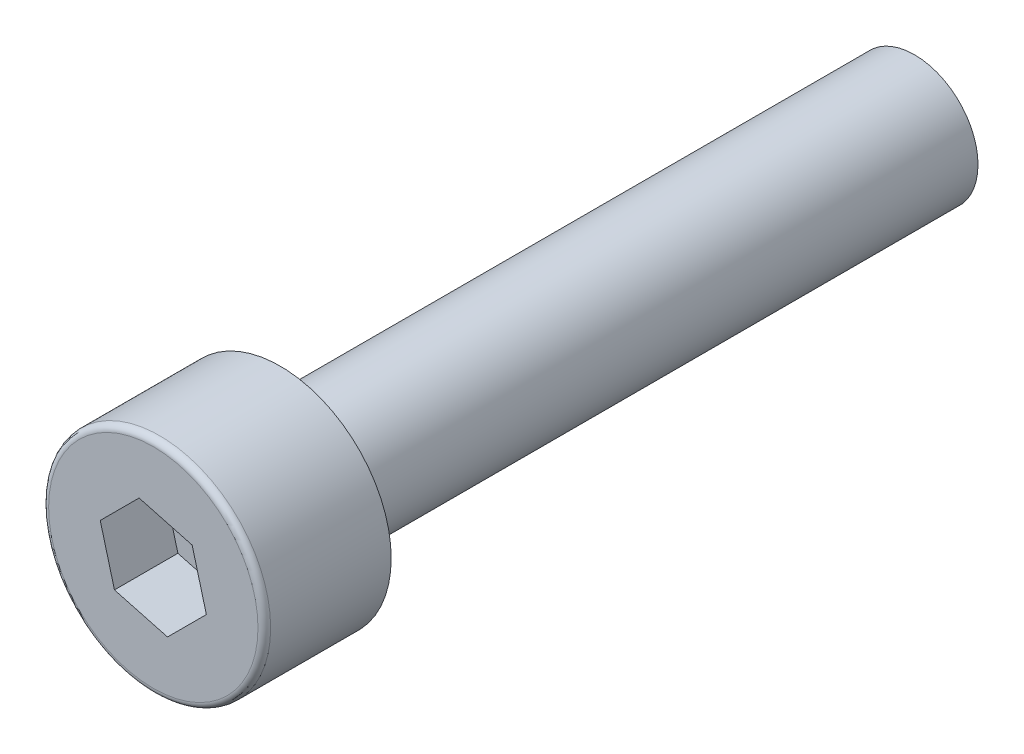
from build123d import *

# Parameters (mm, degrees)
SKETCH_1_R          = 3.5
EXTRUDE_1_DEPTH     = 4
CUT_EXTRUDE_1_DEPTH = 2
SKETCH_3_R          = 2
EXTRUDE_2_DEPTH     = 20
FILLET_1_R          = 0.2


with BuildPart() as part:
    # 草图1 → 凸台-拉伸1 (new body)
    with BuildSketch(Plane.XY):
        Circle(SKETCH_1_R)
    extrude(amount=EXTRUDE_1_DEPTH)

    # 草图2 → 切除-拉伸1 (cut)
    with BuildSketch(Plane.XY.offset(4)):
        Polygon((-1.224744871, -1.224744871), (0.448287736, -1.673032607), (1.673032607, -0.448287736), (1.224744871, 1.224744871), (-0.448287736, 1.673032607), (-1.673032607, 0.448287736), align=None)
    extrude(amount=-CUT_EXTRUDE_1_DEPTH, mode=Mode.SUBTRACT)

    # 草图3 → 凸台-拉伸2 (add)
    with BuildSketch(Plane(origin=(0, 0, 0), x_dir=(-1, 0, 0), z_dir=(0, 0, -1))):
        with Locations(Location((0, 0, 0), (0, 0, 180))):
            Circle(SKETCH_3_R)
    extrude(amount=EXTRUDE_2_DEPTH)

    # 圆角1
    fillet_1_edges = [part.edges().sort_by_distance(p)[0] for p in [
        (-3.5, 0, 4),
    ]]
    fillet(fillet_1_edges, radius=FILLET_1_R)


solid = part.part
